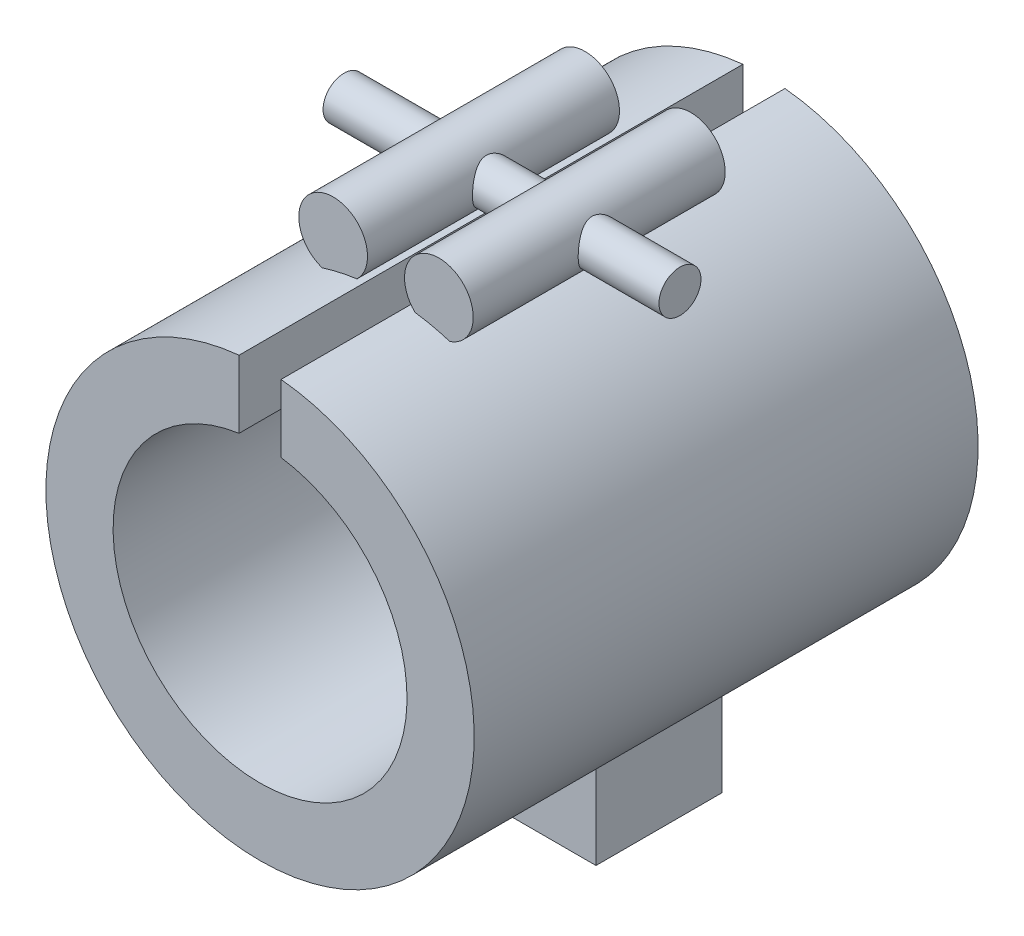
from build123d import *

# Parameters (mm, degrees)
BOSS_EXTRUDE1_DEPTH      = 30
SKETCH2_R                = 4.091242679
BOSS_EXTRUDE2_DEPTH      = 15
SKETCH3_W                = 20
SKETCH3_H                = 12.982921918
BOSS_EXTRUDE3_DEPTH      = 15
BOSS_EXTRUDE5_DEPTH      = 20
BOSS_EXTRUDE5_DEPTH_BACK = 20
SKETCH5_R                = 2.5


with BuildPart() as part:
    # Sketch1 → Boss-Extrude1 (new, symmetric)
    with BuildSketch(Plane.XY):
        with BuildLine():
            Line((-2.5, 25.377155081), (-2.5, 17.320508076))
            ThreePointArc((-2.5, 17.320508076), (0, -17.5), (2.5, 17.320508076))
            Line((2.5, 17.320508076), (2.5, 25.377155081))
            ThreePointArc((2.5, 25.377155081), (0, -25.5), (-2.5, 25.377155081))
        make_face()
    extrude(amount=BOSS_EXTRUDE1_DEPTH, both=True)

    # Sketch2 → Boss-Extrude2 (add, symmetric)
    with BuildSketch(Plane.XY):
        with Locations((6.293533022, 28.211487403)):
            Circle(SKETCH2_R)
        with Locations((-6.293533022, 28.211487403)):
            Circle(SKETCH2_R)
    extrude(amount=BOSS_EXTRUDE2_DEPTH, both=True)

    # Sketch3 → Boss-Extrude3 (add)
    with BuildSketch(Plane.XY):
        with Locations((0, -29.508539041)):
            Rectangle(SKETCH3_W, SKETCH3_H)
    extrude(amount=-BOSS_EXTRUDE3_DEPTH)

    # Sketch5 → Boss-Extrude5 (add, two sides: drawn at the far end of the back side and taken through both)
    with BuildSketch(Plane(origin=(0, 0, 0), x_dir=(0, 0, -1), z_dir=(1, 0, 0)).offset(-BOSS_EXTRUDE5_DEPTH_BACK)):
        with Locations((0, 28.211487403)):
            Circle(SKETCH5_R)
    extrude(amount=BOSS_EXTRUDE5_DEPTH + BOSS_EXTRUDE5_DEPTH_BACK)


solid = part.part
